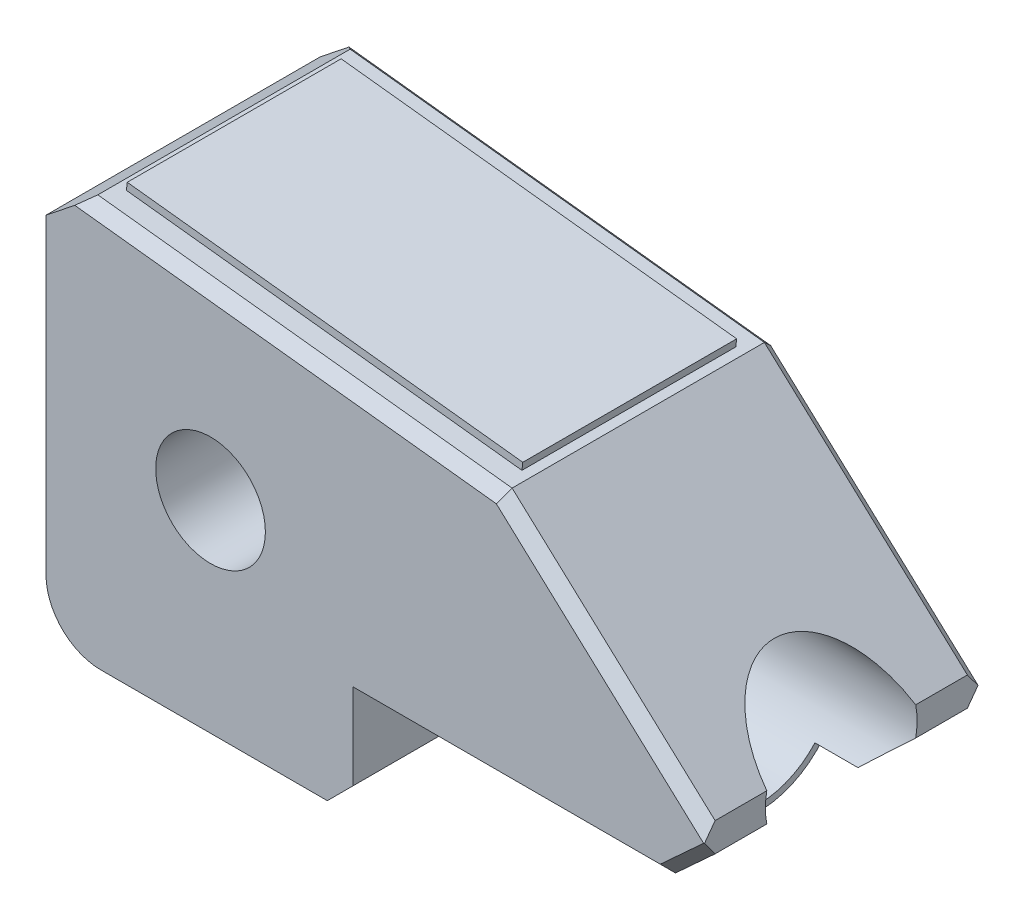
from build123d import *

# Parameters (mm, degrees)
SKETCH2_R           = 10
BOSS_EXTRUDE1_DEPTH = 50
CUT_EXTRUDE1_DEPTH  = 64.068151531
BOSS_EXTRUDE2_START = 49
BOSS_EXTRUDE2_DEPTH = 49
FILLET1_R           = 10
CHAMFER1_SIZE       = 7.5
CHAMFER1_SIZE2      = 6.781071912
CHAMFER2_SIZE       = 2
CHAMFER3_SIZE       = 2
FILLET2_R           = 2
SCALE1_SCALE        = 2
SCALE2_SCALE        = 1.1
SKETCH5_W           = 159.672226339
SKETCH5_H           = 42.890755139
SKETCH5_H_2         = 42.890755138
BOSS_EXTRUDE3_DEPTH = 3


with BuildPart() as part:
    # Sketch2 → Boss-Extrude1 (new body)
    with BuildSketch(Plane.XY):
        Polygon((40.193713233, 38.980676174), (-42.791413838, 48.363568548), (-42.791413838, -25.22727884), (8.499789264, -25.22727884), (13.140434631, -20.586633473), (13.140434631, -6.901832716), (69.990252121, -6.901832716), (77.208586162, -0.271434231), (77.208586162, 4.980676174), align=None)
        with Locations((-12.791413838, 11.568144854)):
            Circle(SKETCH2_R, mode=Mode.SUBTRACT)
    extrude(amount=BOSS_EXTRUDE1_DEPTH)

    # Sketch3 → Cut-Extrude1 (cut)
    with BuildSketch(Plane(origin=(77.208586162, 0, 0), x_dir=(0, 0, -1), z_dir=(1, 0, 0))):
        with BuildLine():
            Line((-38.573939088, 4.980676174), (-25, 4.980676174))
            Line((-25, 4.980676174), (-11.426060912, 4.980676174))
            ThreePointArc((-11.426060912, 4.980676174), (-25, 16.180248925), (-38.573939088, 4.980676174))
        make_face()
        with BuildLine():
            Line((-38.573939088, -0.271434231), (-25, -0.271434231))
            Line((-25, -0.271434231), (-25, 4.980676174))
            Line((-25, 4.980676174), (-38.573939088, 4.980676174))
            ThreePointArc((-38.573939088, 4.980676174), (-38.825627953, 2.354620972), (-38.573939088, -0.271434231))
        make_face()
        with BuildLine():
            Line((-25, 4.980676174), (-25, -0.271434231))
            Line((-25, -0.271434231), (-11.426060912, -0.271434231))
            ThreePointArc((-11.426060912, -0.271434231), (-11.237438102, 1.035576506), (-11.174372047, 2.354620972))
            ThreePointArc((-11.174372047, 2.354620972), (-11.237438102, 3.673665437), (-11.426060912, 4.980676174))
            Line((-11.426060912, 4.980676174), (-25, 4.980676174))
        make_face()
        with BuildLine():
            Line((-11.426060912, -0.271434231), (-25, -0.271434231))
            Line((-25, -0.271434231), (-38.573939088, -0.271434231))
            ThreePointArc((-38.573939088, -0.271434231), (-25, -11.471006981), (-11.426060912, -0.271434231))
        make_face()
    extrude(amount=-CUT_EXTRUDE1_DEPTH, mode=Mode.SUBTRACT)

    # Sketch4 → Boss-Extrude2 (add)
    with BuildSketch(Plane(origin=(13.140434631, 0, 0), x_dir=(0, 0, -1), z_dir=(1, 0, 0)).offset(BOSS_EXTRUDE2_START)):
        with BuildLine():
            Line((-13.196692619, -6.901832716), (-14.730333334, -6.901832716))
            ThreePointArc((-14.730333334, -6.901832716), (-25, -11.471006981), (-35.269666666, -6.901832716))
            Line((-35.269666666, -6.901832716), (-36.803307381, -6.901832716))
            ThreePointArc((-36.803307381, -6.901832716), (-25, -12.645379028), (-13.196692619, -6.901832716))
        make_face()
    extrude(amount=-BOSS_EXTRUDE2_DEPTH)

    # Fillet1
    fillet1_edges = [part.edges().sort_by_distance(p)[0] for p in [
        (-42.791413838, -25.22727884, 25),
    ]]
    fillet(fillet1_edges, radius=FILLET1_R)

    # Chamfer1
    chamfer1_edges = [part.edges().sort_by_distance(p)[0] for p in [
        (-42.791413838, 48.363568548, 25),
    ]]
    chamfer1_side = [part.faces().sort_by_distance(p)[0] for p in [
        (-1.298850303, 43.672122361, 25),
    ]]
    chamfer(chamfer1_edges, length=CHAMFER1_SIZE, length2=CHAMFER1_SIZE2, reference=chamfer1_side[0])

    # Chamfer2
    chamfer2_edges = [part.edges().sort_by_distance(p)[0] for p in [
        (2.427406766, 43.250805069, 0),
        (58.701149697, 21.980676174, 0),
        (58.701149697, 21.980676174, 50),
        (2.427406766, 43.250805069, 50),
    ]]
    chamfer(chamfer2_edges, length=CHAMFER2_SIZE)

    # Chamfer3
    chamfer3_edges = [part.edges().sort_by_distance(p)[0] for p in [
        (41.565343376, -6.901832716, 50),
        (73.599419141, -3.586633473, 50),
        (73.599419141, -3.586633473, 0),
        (41.565343376, -6.901832716, 0),
    ]]
    chamfer(chamfer3_edges, length=CHAMFER3_SIZE)

    # Fillet2
    fillet2_edges = [part.edges().sort_by_distance(p)[0] for p in [
        (13.140434631, -6.901832716, 7.598346309),
        (13.140434631, -12.645379028, 25),
        (13.140434631, -6.901832716, 42.401653691),
    ]]
    fillet(fillet2_edges, radius=FILLET2_R)


with BuildPart() as part_1:
    # Scale1: scaled about (1.71120361, 12.165140941, 25)
    add(part.part.scale(SCALE1_SCALE).moved(Location((-1.71120361, -12.165140941, -25))))


with BuildPart() as part_2:
    # Scale2: scaled about (1.711203609, 12.165140942, 25)
    add(part_1.part.scale(SCALE2_SCALE).moved(Location((-0.171120361, -1.216514094, -2.5))))

    # Sketch5 → Boss-Extrude3 (add)
    with BuildSketch(Plane(origin=(9.034485149, 79.903708601, 0), x_dir=(0.993668551555422, -0.11235127791774192, 0), z_dir=(0.11235127791774194, 0.9936685515554221, 0))):
        with Locations((-5.784473025, -46.445353997)):
            Rectangle(SKETCH5_W, SKETCH5_H)
        with Locations((-5.784473025, -3.554598859)):
            Rectangle(SKETCH5_W, SKETCH5_H_2)
    extrude(amount=BOSS_EXTRUDE3_DEPTH)


solid = part_2.part
